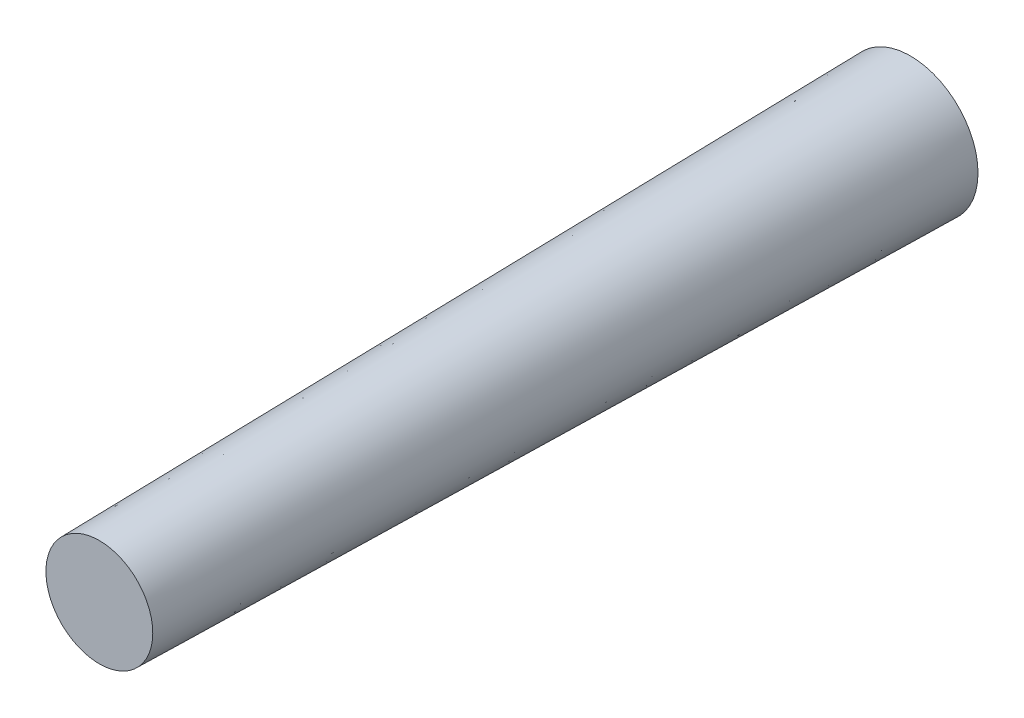
from build123d import *

# Parameters (mm, degrees)
SKETCH1_R           = 2.5
BOSS_EXTRUDE1_DEPTH = 30
DRAFT2_ANGLE        = 1
DRAFT4_ANGLE        = -1


with BuildPart() as part:
    # Sketch1 → Boss-Extrude1 (new body)
    with BuildSketch(Plane.XY):
        Circle(SKETCH1_R)
    extrude(amount=BOSS_EXTRUDE1_DEPTH)

    # Draft2
    draft2_faces = [part.faces().sort_by_distance(p)[0] for p in [
        (-2.5, 0, 15),
    ]]
    draft(draft2_faces, Plane(origin=(0, 0, 0), x_dir=(-1, 0, 0), z_dir=(0, 0, -1)), DRAFT2_ANGLE)

    # Draft4
    draft4_faces = [part.faces().sort_by_distance(p)[0] for p in [
        (-2.761825974, 0, 15),
    ]]
    draft(draft4_faces, Plane(origin=(0, 0, 0), x_dir=(-1, 0, 0), z_dir=(0, 0, -1)), DRAFT4_ANGLE)


solid = part.part
